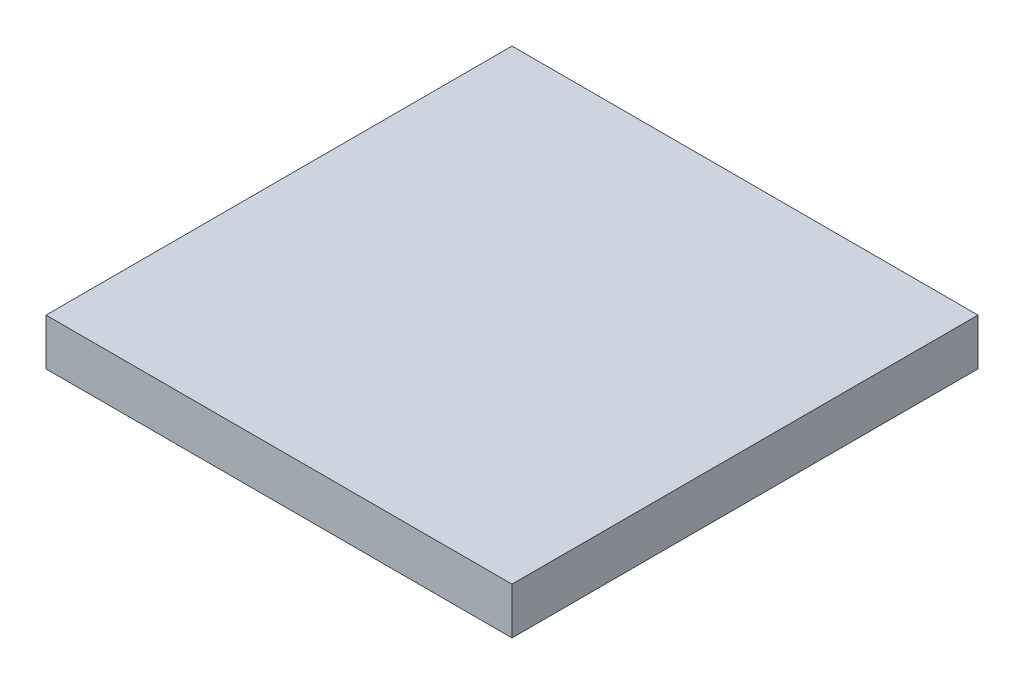
from build123d import *

# Parameters (mm, degrees)
SKETCH1_W           = 500
SKETCH1_H           = 500
BOSS_EXTRUDE1_DEPTH = 50


with BuildPart() as part:
    # Sketch1 → Boss-Extrude1 (new body)
    with BuildSketch(Plane(origin=(0, 0, 0), x_dir=(1, 0, 0), z_dir=(0, 1, 0))):
        Rectangle(SKETCH1_W, SKETCH1_H)
    extrude(amount=BOSS_EXTRUDE1_DEPTH)


solid = part.part
